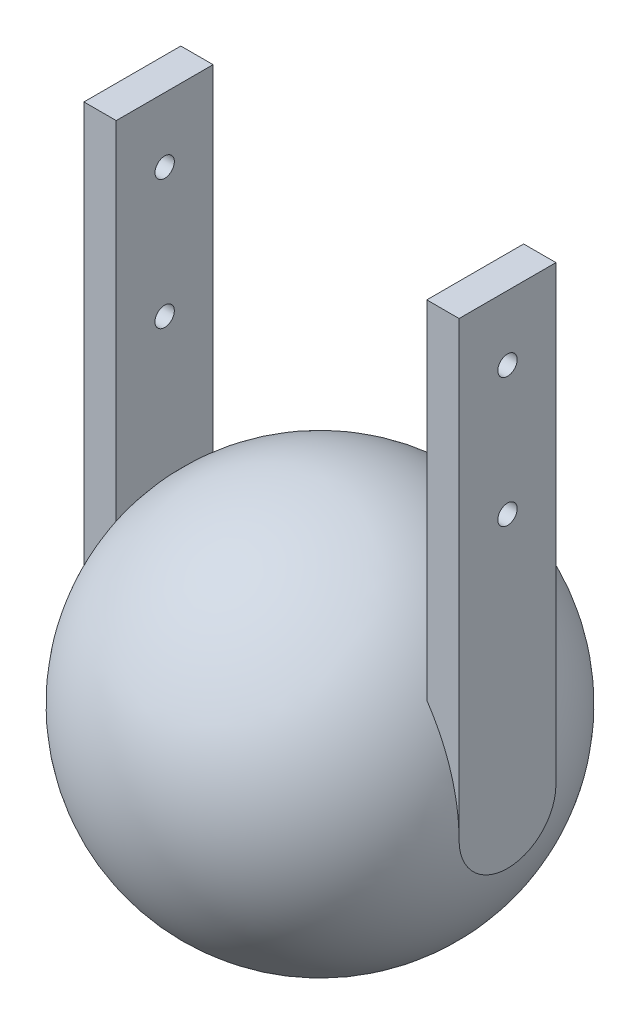
from build123d import *

# Parameters (mm, degrees)
BOSS_EXTRUDE1_DEPTH   = 5
F_3_0MM_DOWEL_HOLE1_D = 3


with BuildPart() as part:
    # Sketch2 → Revolve1 (revolve)
    with BuildSketch(Plane(origin=(0, 0, 0), x_dir=(1, 0, 0), z_dir=(0, 1, 0))):
        with BuildLine():
            Line((29.047375097, 0), (29.047375097, 7.5))
            ThreePointArc((29.047375097, 7.5), (0, 30), (-29.047375097, 7.5))
            Line((-29.047375097, 7.5), (-29.047375097, 0))
            Line((-29.047375097, 0), (29.047375097, 0))
        make_face()
    revolve(axis=Axis((-29.047375097, 0, 0), (1, 0, 0)))

    # Sketch3 → Boss-Extrude1 (add)
    with BuildSketch(Plane.ZY.offset(29.047375097)):
        with BuildLine():
            Line((-7.5, 0), (-7.5, 70))
            Line((-7.5, 70), (7.5, 70))
            Line((7.5, 70), (7.5, 0))
            ThreePointArc((7.5, 0), (0, -7.5), (-7.5, 0))
        make_face()
    boss_extrude1 = extrude(amount=-BOSS_EXTRUDE1_DEPTH)

    # Mirror1: Boss-Extrude1 across plane
    add(boss_extrude1.mirror(Plane(origin=(0, 0, 0), x_dir=(0, 0, 1), z_dir=(1, 0, 0))))

    # Ø3.0mm Dowel Hole1 (through all)
    with Locations(Plane.ZY.offset(29.047375097)):
        with Locations((0, 60), (0, 40)):
            Hole(F_3_0MM_DOWEL_HOLE1_D / 2)


solid = part.part
